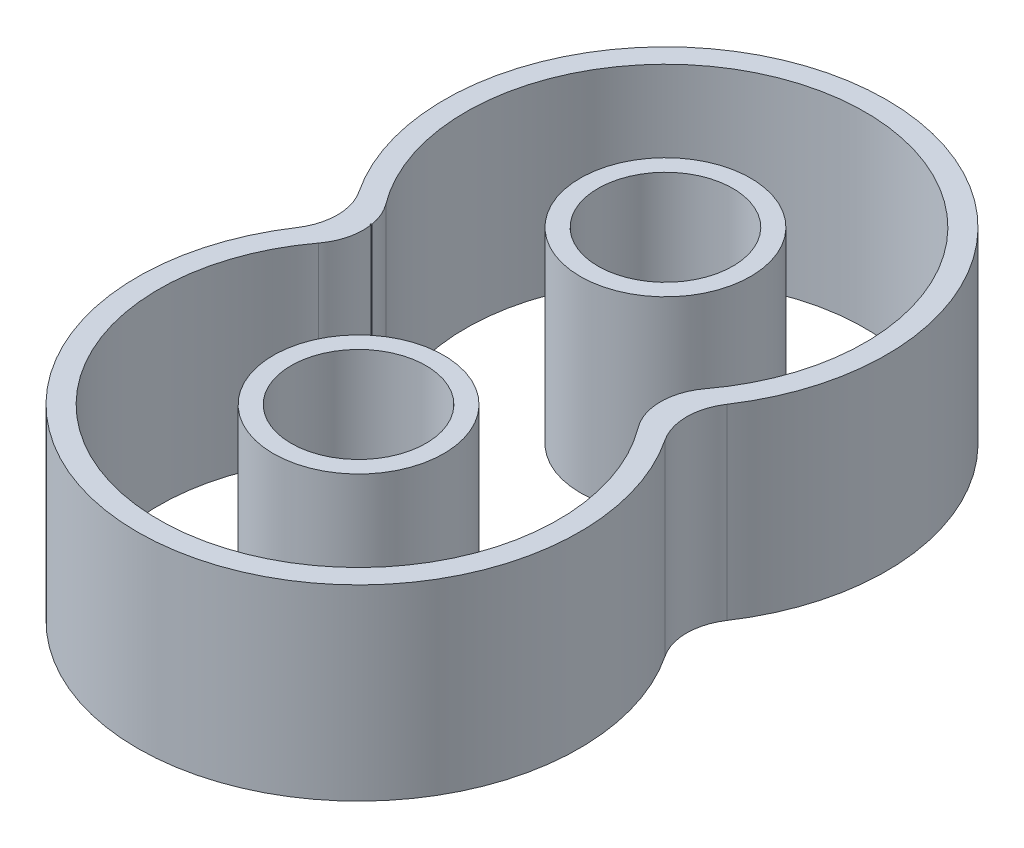
from build123d import *

# Parameters (mm, degrees)
BOSS_EXTRUDE1_DEPTH   = 100
SKETCH8_R             = 45.5
SKETCH8_R_2           = 36
BOSS_EXTRUDE1_2_DEPTH = 100
BOSS_EXTRUDE1_3_DEPTH = 100


with BuildPart() as part:
    # Sketch8 → Boss-Extrude1 (new body)
    with BuildSketch(Plane(origin=(0, 0, 0), x_dir=(1, 0, 0), z_dir=(0, 1, 0))):
        with BuildLine():
            ThreePointArc((-100.274105053, 16.605563859), (-95.259205592, 0), (-100.274105053, -16.605563859))
            ThreePointArc((-100.274105053, -16.605563859), (-1.982836217, -199.951634424), (96.308432618, -16.605563859))
            ThreePointArc((96.308432618, -16.605563859), (91.293533157, 0), (96.308432618, 16.605563859))
            ThreePointArc((96.308432618, 16.605563859), (-1.982836217, 199.951634424), (-100.274105053, 16.605563859))
        make_face()
        with BuildLine():
            ThreePointArc((83.369924338, 17.98736622), (77.379394479, 0), (83.369924338, -17.98736622))
            ThreePointArc((83.369924338, -17.98736622), (-1.982836217, -188.580642728), (-87.335596772, -17.98736622))
            ThreePointArc((-87.335596772, -17.98736622), (-82.260099756, -7.352869197), (-81.671870152, 4.416038264))
            Line((-81.671870152, 4.416038264), (-82.436192616, 4.416038264))
            ThreePointArc((-82.436192616, 4.416038264), (-82.103728119, 4.72461595), (-81.770080085, 5.031913559))
            ThreePointArc((-81.770080085, 5.031913559), (-83.780879177, 11.841264898), (-87.335596772, 17.98736622))
            ThreePointArc((-87.335596772, 17.98736622), (-1.982836217, 188.580642728), (83.369924338, 17.98736622))
        make_face(mode=Mode.SUBTRACT)
    extrude(amount=BOSS_EXTRUDE1_DEPTH)


with BuildPart() as body_2:
    # Sketch8 → Boss-Extrude1 2 (new body)
    with BuildSketch(Plane(origin=(0, 0, 0), x_dir=(1, 0, 0), z_dir=(0, 1, 0))):
        with Locations(Location((-1.982836217, 81.931774528, 0), (0, 0, 270))):
            Circle(SKETCH8_R)
        with Locations(Location((-1.982836217, 81.931774528, 0), (0, 0, 270))):
            Circle(SKETCH8_R_2, mode=Mode.SUBTRACT)
    extrude(amount=BOSS_EXTRUDE1_2_DEPTH)


with BuildPart() as body_3:
    # Sketch8 → Boss-Extrude1 3 (new body)
    with BuildSketch(Plane(origin=(0, 0, 0), x_dir=(1, 0, 0), z_dir=(0, 1, 0))):
        with Locations(Location((-1.982836217, -81.931774528, 0), (0, 0, 270))):
            Circle(SKETCH8_R)
        with Locations(Location((-1.982836217, -81.931774528, 0), (0, 0, 270))):
            Circle(SKETCH8_R_2, mode=Mode.SUBTRACT)
    extrude(amount=BOSS_EXTRUDE1_3_DEPTH)


solid = Compound([part.part, body_2.part, body_3.part])
